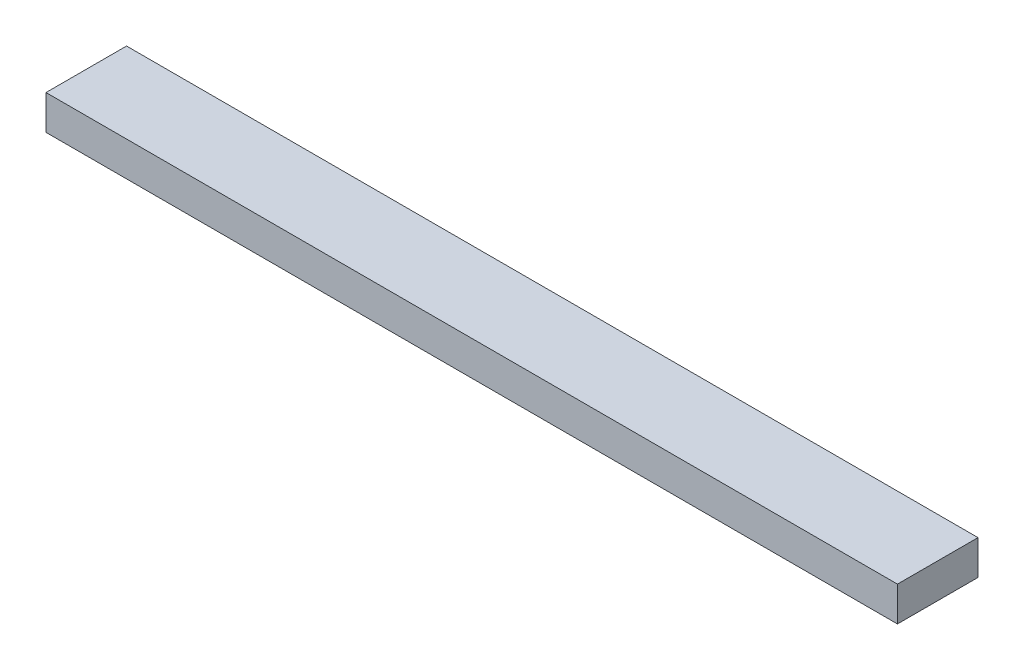
from build123d import *

# Parameters (mm, degrees)
SKETCH1_W           = 939.6984
SKETCH1_H           = 38.1
BOSS_EXTRUDE1_DEPTH = 88.9


with BuildPart() as part:
    # Sketch1 → Boss-Extrude1 (new body)
    with BuildSketch(Plane.XY):
        Rectangle(SKETCH1_W, SKETCH1_H)
    extrude(amount=BOSS_EXTRUDE1_DEPTH)


solid = part.part
